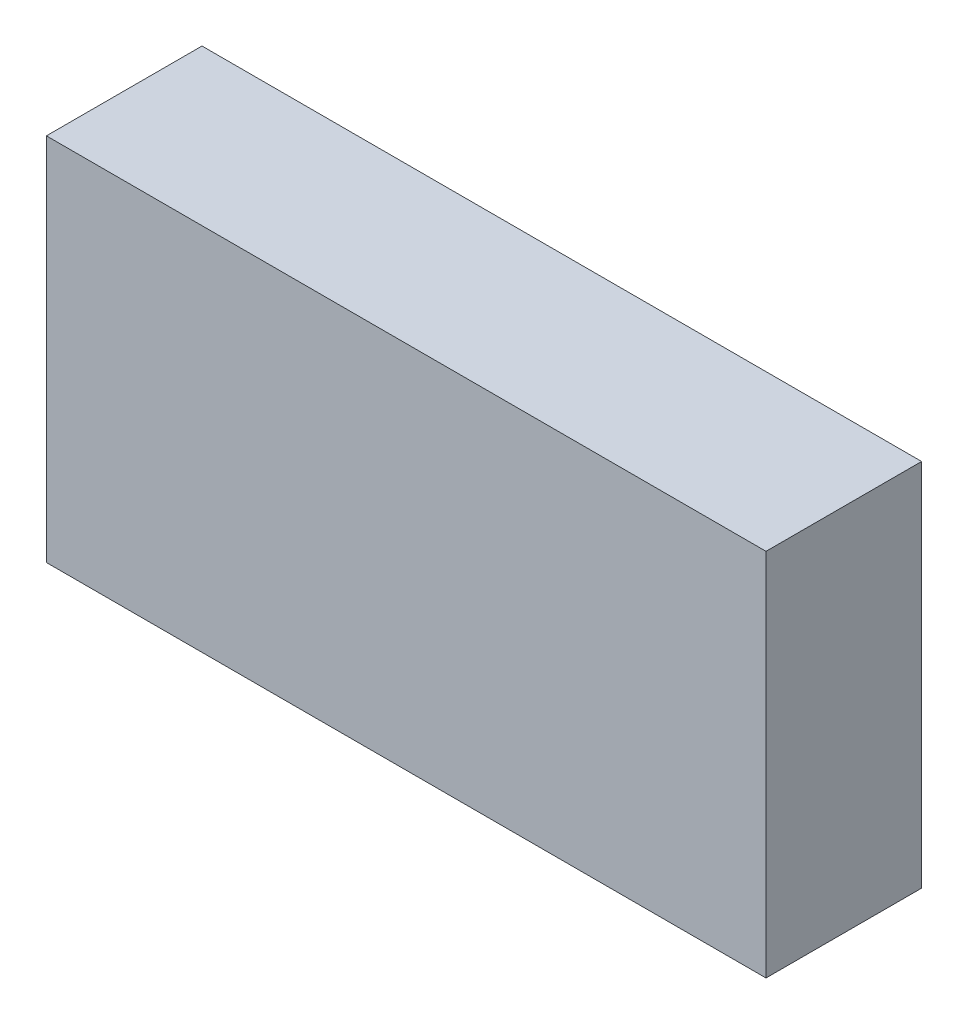
from build123d import *

# Parameters (mm, degrees)
SKETCH1_W           = 37
SKETCH1_H           = 19
BOSS_EXTRUDE1_DEPTH = 4


with BuildPart() as part:
    # Sketch1 → Boss-Extrude1 (new, symmetric)
    with BuildSketch(Plane.XY):
        Rectangle(SKETCH1_W, SKETCH1_H)
    extrude(amount=BOSS_EXTRUDE1_DEPTH, both=True)


solid = part.part
